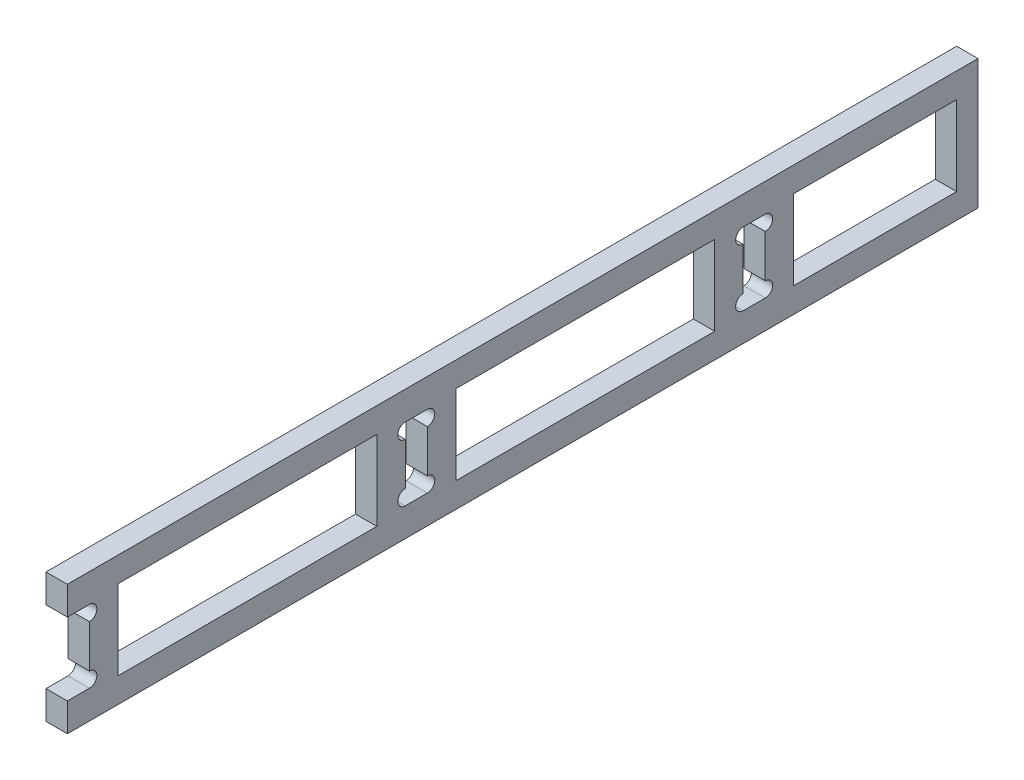
from build123d import *

# Parameters (mm, degrees)
SKETCH_1_W      = 36.4
SKETCH_1_H      = 11.2
EXTRUDE_1_DEPTH = 3
SKETCH_2_W      = 22.91
SKETCH_2_H      = 11.2
EXTRUDE_2_DEPTH = 3


with BuildPart() as part:
    # 草图1 → 凸台-拉伸1 (new body)
    with BuildSketch(Plane(origin=(0, 0, 0), x_dir=(0, 0, -1), z_dir=(1, 0, 0))):
        with BuildLine():
            ThreePointArc((-44.9, -4.05), (-45.20753788, -4.79246212), (-45.95, -5.1))
            Line((-45.95, -5.1), (-49.05, -5.1))
            Line((-49.05, -5.1), (-49.05, -9.1))
            Line((-49.05, -9.1), (49.05, -9.1))
            Line((49.05, -9.1), (49.05, -5.1))
            Line((49.05, -5.1), (45.95, -5.1))
            ThreePointArc((45.95, -5.1), (44.9, -4.05), (45.95, -3))
            Line((45.95, -3), (45.95, 3))
            ThreePointArc((45.95, 3), (44.9, 4.05), (45.95, 5.1))
            Line((45.95, 5.1), (49.05, 5.1))
            Line((49.05, 5.1), (49.05, 9.1))
            Line((49.05, 9.1), (-49.05, 9.1))
            Line((-49.05, 9.1), (-49.05, 5.1))
            Line((-49.05, 5.1), (-45.95, 5.1))
            ThreePointArc((-45.95, 5.1), (-45.20753788, 4.79246212), (-44.9, 4.05))
            ThreePointArc((-44.9, 4.05), (-45.20753788, 3.30753788), (-45.95, 3))
            Line((-45.95, 3), (-45.95, -3))
            ThreePointArc((-45.95, -3), (-45.20753788, -3.30753788), (-44.9, -4.05))
        make_face()
        with Locations((-23.75, 0)):
            Rectangle(SKETCH_1_W, SKETCH_1_H, mode=Mode.SUBTRACT)
        with BuildLine():
            ThreePointArc((2.6, -4.05), (2.29246212, -4.79246212), (1.55, -5.1))
            Line((1.55, -5.1), (-1.55, -5.1))
            ThreePointArc((-1.55, -5.1), (-2.6, -4.05), (-1.55, -3))
            Line((-1.55, -3), (-1.55, 3))
            ThreePointArc((-1.55, 3), (-2.6, 4.05), (-1.55, 5.1))
            Line((-1.55, 5.1), (1.55, 5.1))
            ThreePointArc((1.55, 5.1), (2.29246212, 4.79246212), (2.6, 4.05))
            ThreePointArc((2.6, 4.05), (2.29246212, 3.30753788), (1.55, 3))
            Line((1.55, 3), (1.55, -3))
            ThreePointArc((1.55, -3), (2.29246212, -3.30753788), (2.6, -4.05))
        make_face(mode=Mode.SUBTRACT)
        with Locations((23.75, 0)):
            Rectangle(SKETCH_1_W, SKETCH_1_H, mode=Mode.SUBTRACT)
    extrude(amount=EXTRUDE_1_DEPTH)

    # 草图2 → 凸台-拉伸2 (add)
    with BuildSketch(Plane(origin=(3, 0, 0), x_dir=(0, 0, -1), z_dir=(1, 0, 0))):
        with BuildLine():
            Line((49.05, -5.1), (49.05, -9.1))
            Line((49.05, -9.1), (78.96, -9.1))
            Line((78.96, -9.1), (78.96, 9.1))
            Line((78.96, 9.1), (49.05, 9.1))
            Line((49.05, 9.1), (49.05, 5.1))
            ThreePointArc((49.05, 5.1), (49.79246212, 4.79246212), (50.1, 4.05))
            ThreePointArc((50.1, 4.05), (49.79246212, 3.30753788), (49.05, 3))
            Line((49.05, 3), (49.05, -3))
            ThreePointArc((49.05, -3), (49.79246212, -3.30753788), (50.1, -4.05))
            ThreePointArc((50.1, -4.05), (49.79246212, -4.79246212), (49.05, -5.1))
        make_face()
        with Locations((64.505, 0)):
            Rectangle(SKETCH_2_W, SKETCH_2_H, mode=Mode.SUBTRACT)
    extrude(amount=-EXTRUDE_2_DEPTH)


solid = part.part
